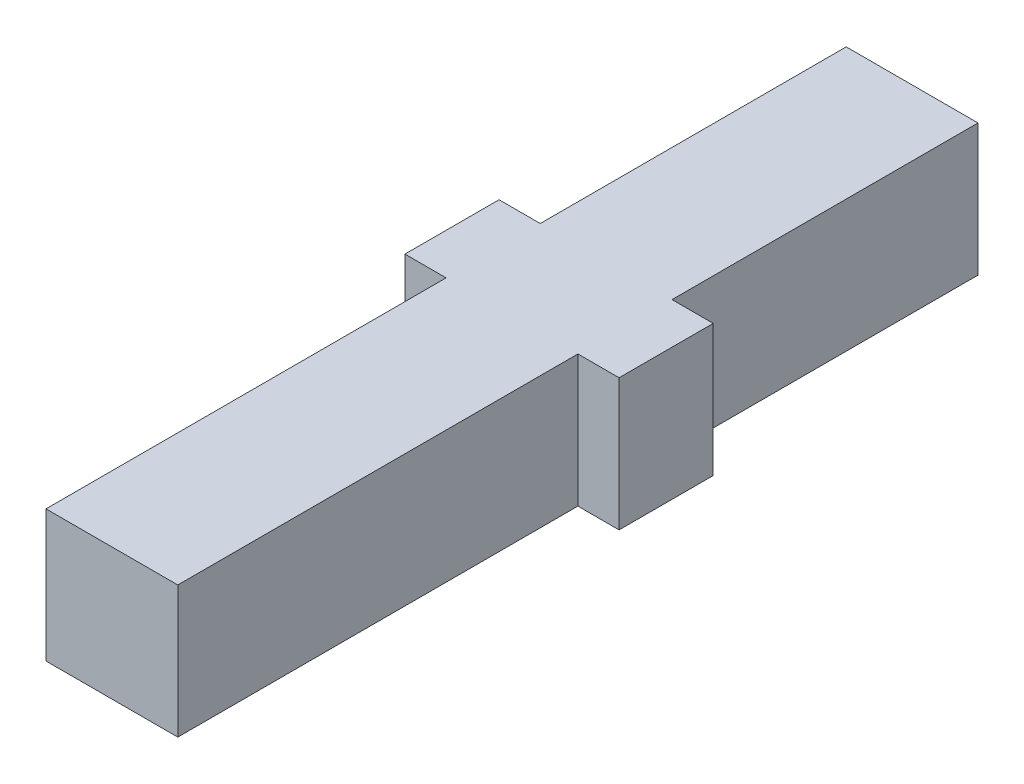
from build123d import *

# Parameters (mm, degrees)
SKETCH1_W           = 2.8
SKETCH1_H           = 2.8
BOSS_EXTRUDE1_DEPTH = 17
BOSS_EXTRUDE2_START = 6.5
SKETCH1_3_W         = 4.55
SKETCH1_3_H         = 2.8
BOSS_EXTRUDE2_DEPTH = 2


with BuildPart() as part:
    # Sketch1 → Boss-Extrude1 (new body)
    with BuildSketch(Plane.XY):
        with Locations((2.375, 1.5)):
            Rectangle(SKETCH1_W, SKETCH1_H)
    extrude(amount=BOSS_EXTRUDE1_DEPTH)

    # Sketch1<3> → Boss-Extrude2 (add)
    with BuildSketch(Plane.XY.offset(BOSS_EXTRUDE2_START)):
        with Locations((2.375, 1.5)):
            Rectangle(SKETCH1_3_W, SKETCH1_3_H)
    extrude(amount=BOSS_EXTRUDE2_DEPTH)


solid = part.part
